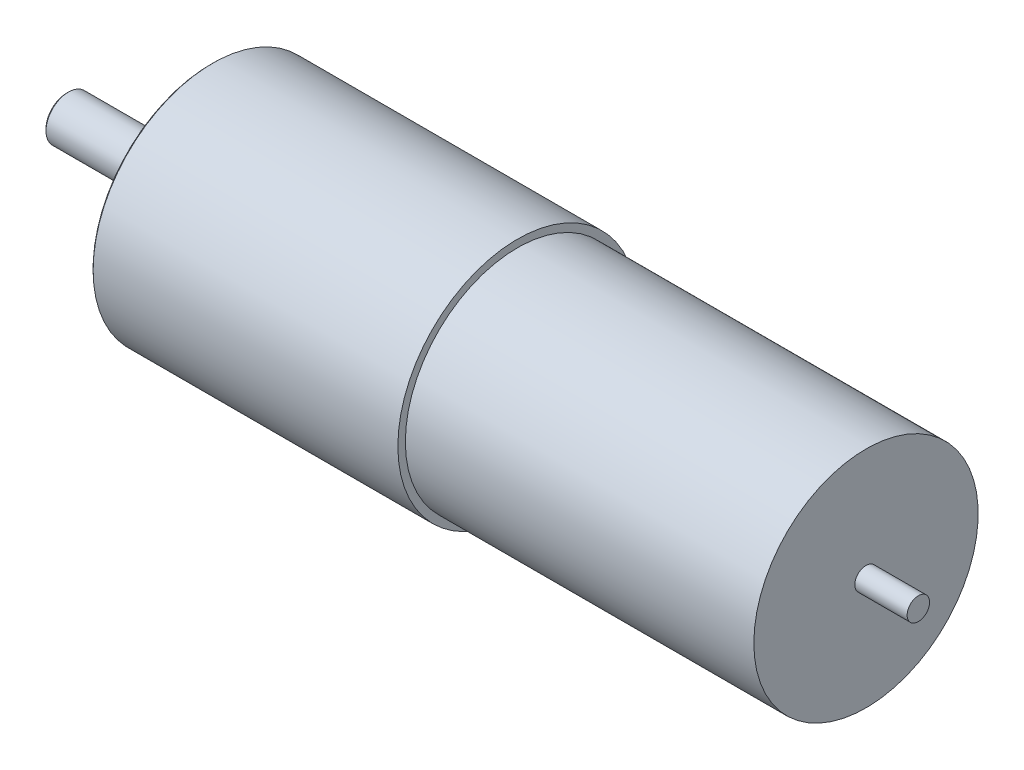
from build123d import *

# Parameters (mm, degrees)
CUT_EXTRUDE1_DEPTH        = 117.125836918
CUT_EXTRUDE1_DEPTH_BACK   = 117.125836918
SKETCH2_W                 = 12
SKETCH2_H                 = 0.5
CHAMFER1_SIZE             = 0.25
SKETCH3_W                 = 20
SKETCH3_H                 = 2
CUT_EXTRUDE2_DEPTH        = 3
M3X0_5_TAPPED_HOLE1_D     = 2.5
M3X0_5_TAPPED_HOLE1_DEPTH = 5.5
M3X0_5_TAPPED_HOLE1_TIP   = 0.751075774


with BuildPart() as part:
    # Sketch1 → Revolve1 (revolve)
    with BuildSketch(Plane(origin=(0, 0, 0), x_dir=(1, 0, 0), z_dir=(0, 1, 0)), mode=Mode.PRIVATE) as revolve1_sk:
        Polygon((0, 0), (113.9, 0), (113.9, 1.5), (106.9, 1.5), (106.9, 15), (60.3, 15), (60.3, 16), (19.3, 16), (19.3, 10), (16.3, 10), (16.3, 3), (0, 3), align=None)
    revolve(revolve1_sk.sketch.rotate(Axis((0, 0, 0), (1, 0, 0)), 180), axis=Axis((0, 0, 0), (1, 0, 0)))

    # Sketch2 → Cut-Extrude1 (cut, two sides: drawn at the far end of the back side and taken through both)
    with BuildSketch(Plane(origin=(0, 0, 0), x_dir=(1, 0, 0), z_dir=(0, 1, 0)).offset(-CUT_EXTRUDE1_DEPTH_BACK)):
        with Locations((6, 2.75)):
            Rectangle(SKETCH2_W, SKETCH2_H)
    extrude(amount=CUT_EXTRUDE1_DEPTH + CUT_EXTRUDE1_DEPTH_BACK, mode=Mode.SUBTRACT)

    # Chamfer1
    chamfer1_edges = [part.edges().sort_by_distance(p)[0] for p in [
        (19.3, 0, -16),
        (0, 2.872281323, 0.866025404),
    ]]
    chamfer(chamfer1_edges, length=CHAMFER1_SIZE)

    # Sketch3 → Cut-Extrude2 (cut)
    with BuildSketch(Plane.ZY.offset(-16.3)):
        with Locations((0, 10)):
            Rectangle(SKETCH3_W, SKETCH3_H)
        with Locations((0, -10)):
            Rectangle(SKETCH3_W, SKETCH3_H)
    extrude(amount=-CUT_EXTRUDE2_DEPTH, mode=Mode.SUBTRACT)

    # M3x0.5 Tapped Hole1
    with Locations(Plane.ZY.offset(-19.3)):
        with Locations((-9.192388155, -9.192388155), (-9.192388155, 9.192388155), (9.192388155, 9.192388155), (9.192388155, -9.192388155)):
            Hole(M3X0_5_TAPPED_HOLE1_D / 2, depth=M3X0_5_TAPPED_HOLE1_DEPTH)
            with Locations((0, 0, -(M3X0_5_TAPPED_HOLE1_DEPTH + M3X0_5_TAPPED_HOLE1_TIP / 2))):  # 118° drill point
                Cone(0, M3X0_5_TAPPED_HOLE1_D / 2, M3X0_5_TAPPED_HOLE1_TIP, mode=Mode.SUBTRACT)


solid = part.part
